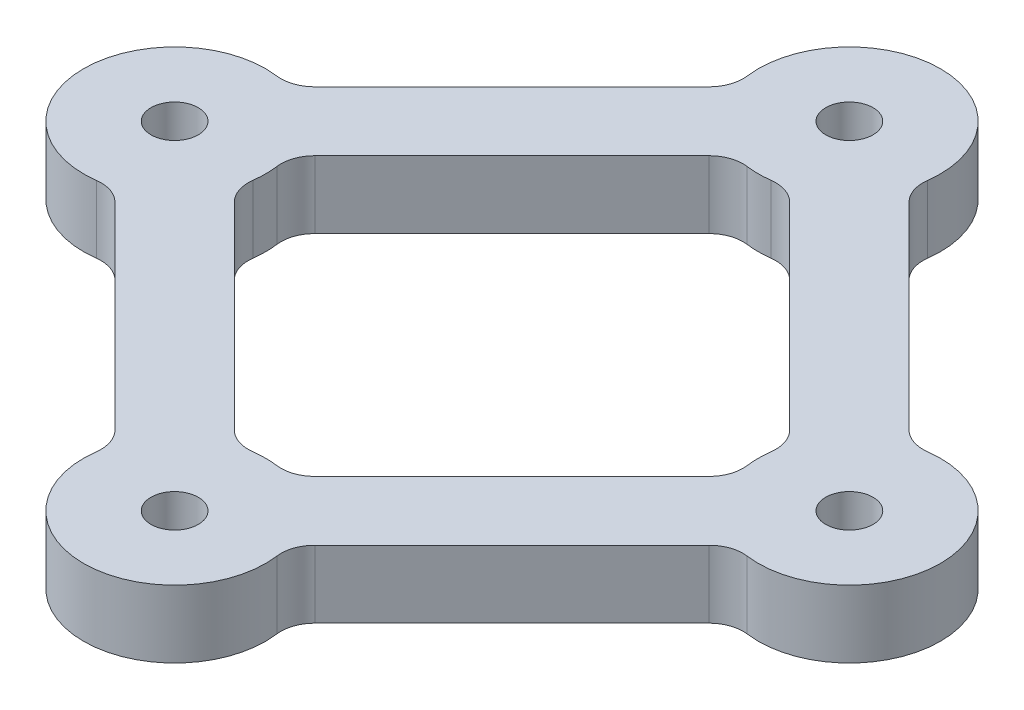
from build123d import *

# Parameters (mm, degrees)
SKETCH2_R           = 0.7
BOSS_EXTRUDE1_DEPTH = 2
FILLET1_R           = 1


with BuildPart() as part:
    # Sketch2 → Boss-Extrude1 (new body)
    # profile 1 of 16: a face of its own
    with BuildSketch(Plane(origin=(0, 0, 0), x_dir=(1, 0, 0), z_dir=(0, 1, 0))):
        with BuildLine():
            Line((-7.423854723, 0.808378324), (-9.191621676, 2.576145277))
            ThreePointArc((-9.191621676, 2.576145277), (-12.7, 0), (-9.191621676, -2.576145277))
            Line((-9.191621676, -2.576145277), (-7.423854723, -0.808378324))
            ThreePointArc((-7.423854723, -0.808378324), (-7.331143293, -0.408905706), (-7.3, 0))
            ThreePointArc((-7.3, 0), (-7.331143293, 0.408905706), (-7.423854723, 0.808378324))
        make_face()
        with Locations(Location((-10, 0, 0), (0, 0, 270))):
            Circle(SKETCH2_R, mode=Mode.SUBTRACT)
    # profile 2 of 16: a face of its own
    with BuildSketch(Plane(origin=(0, 0, 0), x_dir=(1, 0, 0), z_dir=(0, 1, 0))):
        with BuildLine():
            ThreePointArc((-0.808378324, 7.423854723), (-1.909188309, 8.090811691), (-2.576145277, 9.191621676))
            Line((-2.576145277, 9.191621676), (-9.191621676, 2.576145277))
            ThreePointArc((-9.191621676, 2.576145277), (-8.090811691, 1.909188309), (-7.423854723, 0.808378324))
            Line((-7.423854723, 0.808378324), (-0.808378324, 7.423854723))
        make_face()
    # profile 3 of 16: a face of its own
    with BuildSketch(Plane(origin=(0, 0, 0), x_dir=(1, 0, 0), z_dir=(0, 1, 0))):
        with BuildLine():
            ThreePointArc((2.7, 10), (-0.408905706, 12.668856707), (-2.576145277, 9.191621676))
            Line((-2.576145277, 9.191621676), (-0.808378324, 7.423854723))
            ThreePointArc((-0.808378324, 7.423854723), (0, 7.3), (0.808378324, 7.423854723))
            Line((0.808378324, 7.423854723), (2.576145277, 9.191621676))
            ThreePointArc((2.576145277, 9.191621676), (2.668856707, 9.591094294), (2.7, 10))
        make_face()
        with Locations(Location((0, 10, 0), (0, 0, 270))):
            Circle(SKETCH2_R, mode=Mode.SUBTRACT)
    # profile 4 of 16: a face of its own
    with BuildSketch(Plane(origin=(0, 0, 0), x_dir=(1, 0, 0), z_dir=(0, 1, 0))):
        with BuildLine():
            ThreePointArc((2.576145277, 9.191621676), (1.909188309, 8.090811691), (0.808378324, 7.423854723))
            Line((0.808378324, 7.423854723), (7.423854723, 0.808378324))
            ThreePointArc((7.423854723, 0.808378324), (8.090811691, 1.909188309), (9.191621676, 2.576145277))
            Line((9.191621676, 2.576145277), (2.576145277, 9.191621676))
        make_face()
    # profile 5 of 16: a face of its own
    with BuildSketch(Plane(origin=(0, 0, 0), x_dir=(1, 0, 0), z_dir=(0, 1, 0))):
        with BuildLine():
            Line((9.191621676, 2.576145277), (7.423854723, 0.808378324))
            ThreePointArc((7.423854723, 0.808378324), (7.3, 0), (7.423854723, -0.808378324))
            Line((7.423854723, -0.808378324), (9.191621676, -2.576145277))
            ThreePointArc((9.191621676, -2.576145277), (11.598026678, -2.176306673), (12.7, 0))
            ThreePointArc((12.7, 0), (11.598026678, 2.176306673), (9.191621676, 2.576145277))
        make_face()
        with Locations(Location((10, 0, 0), (0, 0, 270))):
            Circle(SKETCH2_R, mode=Mode.SUBTRACT)
    # profile 6 of 16: a face of its own
    with BuildSketch(Plane(origin=(0, 0, 0), x_dir=(1, 0, 0), z_dir=(0, 1, 0))):
        with BuildLine():
            ThreePointArc((9.191621676, -2.576145277), (8.090811691, -1.909188309), (7.423854723, -0.808378324))
            Line((7.423854723, -0.808378324), (0.808378324, -7.423854723))
            ThreePointArc((0.808378324, -7.423854723), (1.909188309, -8.090811691), (2.576145277, -9.191621676))
            Line((2.576145277, -9.191621676), (9.191621676, -2.576145277))
        make_face()
    # profile 7 of 16: a face of its own
    with BuildSketch(Plane(origin=(0, 0, 0), x_dir=(1, 0, 0), z_dir=(0, 1, 0))):
        with BuildLine():
            Line((-0.808378324, -7.423854723), (-2.576145277, -9.191621676))
            ThreePointArc((-2.576145277, -9.191621676), (-0.408905706, -12.668856707), (2.7, -10))
            ThreePointArc((2.7, -10), (2.668856707, -9.591094294), (2.576145277, -9.191621676))
            Line((2.576145277, -9.191621676), (0.808378324, -7.423854723))
            ThreePointArc((0.808378324, -7.423854723), (0, -7.3), (-0.808378324, -7.423854723))
        make_face()
        with Locations(Location((0, -10, 0), (0, 0, 270))):
            Circle(SKETCH2_R, mode=Mode.SUBTRACT)
    # profile 8 of 16: a face of its own
    with BuildSketch(Plane(origin=(0, 0, 0), x_dir=(1, 0, 0), z_dir=(0, 1, 0))):
        with BuildLine():
            ThreePointArc((-7.423854723, -0.808378324), (-8.090811691, -1.909188309), (-9.191621676, -2.576145277))
            Line((-9.191621676, -2.576145277), (-2.576145277, -9.191621676))
            ThreePointArc((-2.576145277, -9.191621676), (-1.909188309, -8.090811691), (-0.808378324, -7.423854723))
            Line((-0.808378324, -7.423854723), (-7.423854723, -0.808378324))
        make_face()
    # profile 9 of 16: a face of its own
    with BuildSketch(Plane(origin=(0, 0, 0), x_dir=(1, 0, 0), z_dir=(0, 1, 0))):
        with BuildLine():
            Line((-7.423854723, -0.808378324), (-9.191621676, -2.576145277))
            ThreePointArc((-9.191621676, -2.576145277), (-8.090811691, -1.909188309), (-7.423854723, -0.808378324))
        make_face()
    # profile 10 of 16: a face of its own
    with BuildSketch(Plane(origin=(0, 0, 0), x_dir=(1, 0, 0), z_dir=(0, 1, 0))):
        with BuildLine():
            ThreePointArc((-7.423854723, 0.808378324), (-8.090811691, 1.909188309), (-9.191621676, 2.576145277))
            Line((-9.191621676, 2.576145277), (-7.423854723, 0.808378324))
        make_face()
    # profile 11 of 16: a face of its own
    with BuildSketch(Plane(origin=(0, 0, 0), x_dir=(1, 0, 0), z_dir=(0, 1, 0))):
        with BuildLine():
            Line((-0.808378324, 7.423854723), (-2.576145277, 9.191621676))
            ThreePointArc((-2.576145277, 9.191621676), (-1.909188309, 8.090811691), (-0.808378324, 7.423854723))
        make_face()
    # profile 12 of 16: a face of its own
    with BuildSketch(Plane(origin=(0, 0, 0), x_dir=(1, 0, 0), z_dir=(0, 1, 0))):
        with BuildLine():
            Line((2.576145277, 9.191621676), (0.808378324, 7.423854723))
            ThreePointArc((0.808378324, 7.423854723), (1.909188309, 8.090811691), (2.576145277, 9.191621676))
        make_face()
    # profile 13 of 16: a face of its own
    with BuildSketch(Plane(origin=(0, 0, 0), x_dir=(1, 0, 0), z_dir=(0, 1, 0))):
        with BuildLine():
            ThreePointArc((9.191621676, 2.576145277), (8.090811691, 1.909188309), (7.423854723, 0.808378324))
            Line((7.423854723, 0.808378324), (9.191621676, 2.576145277))
        make_face()
    # profile 14 of 16: a face of its own
    with BuildSketch(Plane(origin=(0, 0, 0), x_dir=(1, 0, 0), z_dir=(0, 1, 0))):
        with BuildLine():
            Line((9.191621676, -2.576145277), (7.423854723, -0.808378324))
            ThreePointArc((7.423854723, -0.808378324), (8.090811691, -1.909188309), (9.191621676, -2.576145277))
        make_face()
    # profile 15 of 16: a face of its own
    with BuildSketch(Plane(origin=(0, 0, 0), x_dir=(1, 0, 0), z_dir=(0, 1, 0))):
        with BuildLine():
            ThreePointArc((2.576145277, -9.191621676), (1.909188309, -8.090811691), (0.808378324, -7.423854723))
            Line((0.808378324, -7.423854723), (2.576145277, -9.191621676))
        make_face()
    # profile 16 of 16: a face of its own
    with BuildSketch(Plane(origin=(0, 0, 0), x_dir=(1, 0, 0), z_dir=(0, 1, 0))):
        with BuildLine():
            ThreePointArc((-0.808378324, -7.423854723), (-1.909188309, -8.090811691), (-2.576145277, -9.191621676))
            Line((-2.576145277, -9.191621676), (-0.808378324, -7.423854723))
        make_face()
    extrude(amount=BOSS_EXTRUDE1_DEPTH)

    # Fillet1
    fillet1_edges = [part.edges().sort_by_distance(p)[0] for p in [
        (-2.576145277, 1, 9.191621676),
        (-9.191621676, 1, 2.576145277),
        (-9.191621676, 1, -2.576145277),
        (-2.576145277, 1, -9.191621676),
        (2.576145277, 1, -9.191621676),
        (9.191621676, 1, -2.576145277),
        (9.191621676, 1, 2.576145277),
        (2.576145277, 1, 9.191621676),
        (-0.808378324, 1, -7.423854723),
        (-7.423854723, 1, -0.808378324),
        (-7.423854723, 1, 0.808378324),
        (-0.808378324, 1, 7.423854723),
        (0.808378324, 1, 7.423854723),
        (7.423854723, 1, 0.808378324),
        (7.423854723, 1, -0.808378324),
        (0.808378324, 1, -7.423854723),
    ]]
    fillet(fillet1_edges, radius=FILLET1_R)


solid = part.part
